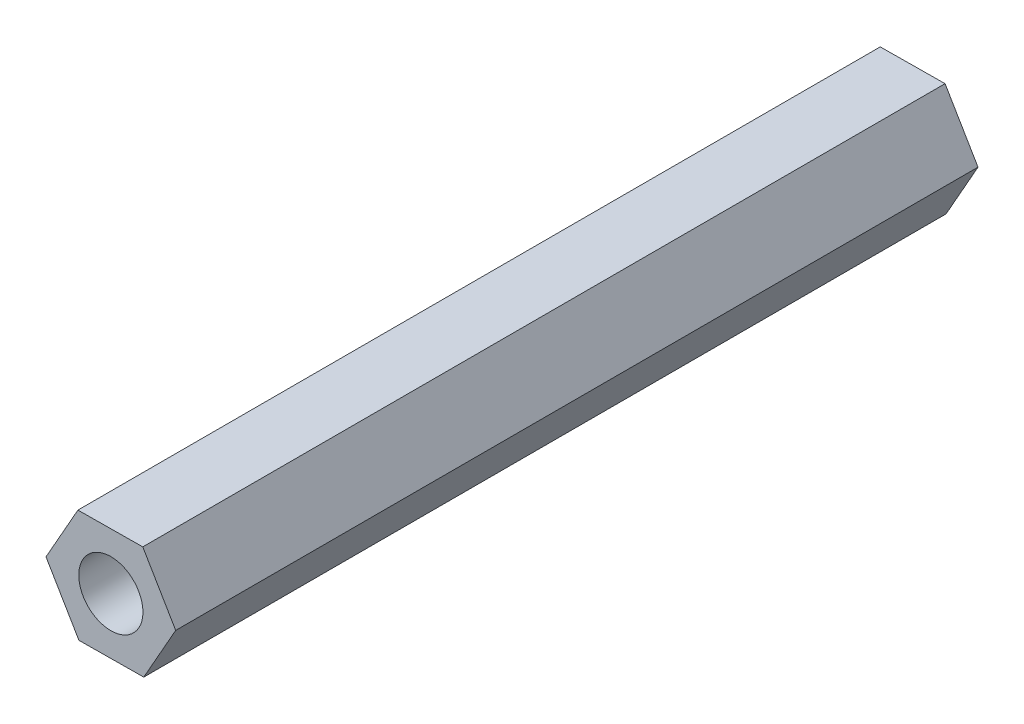
from build123d import *

# Parameters (mm, degrees)
SKETCH_1_R      = 2
EXTRUDE_1_DEPTH = 50


with BuildPart() as part:
    # 草图1 → 凸台-拉伸1 (new body)
    with BuildSketch(Plane.XY):
        Polygon((2.051456248, -3.482077052), (4.041295309, 0.035574699), (1.989839061, 3.517651751), (-2.051456248, 3.482077052), (-4.041295309, -0.035574699), (-1.989839061, -3.517651751), align=None)
        Circle(SKETCH_1_R, mode=Mode.SUBTRACT)
    extrude(amount=EXTRUDE_1_DEPTH)


solid = part.part
